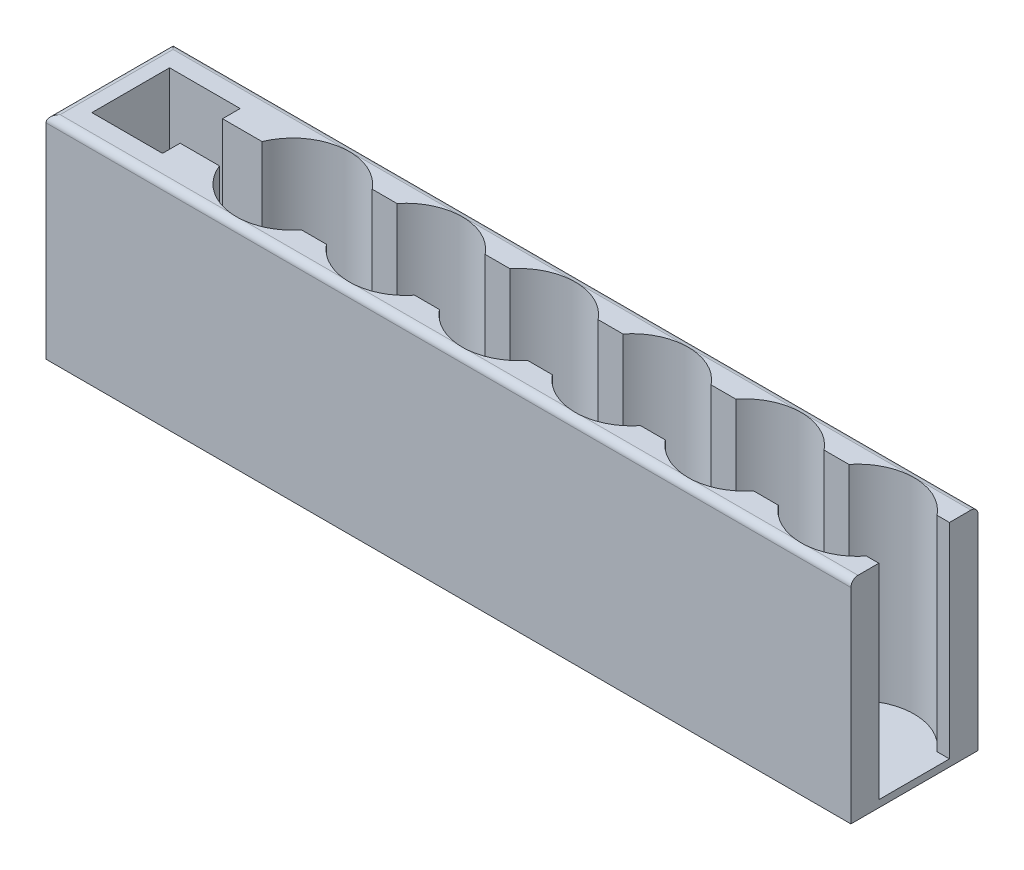
from build123d import *

# Parameters (mm, degrees)
SKETCH1_W           = 114
SKETCH1_H           = 18
BOSS_EXTRUDE1_DEPTH = 30
CUT_EXTRUDE2_DEPTH  = 29
SKETCH4_W           = 6
SKETCH4_H           = 6
CUT_EXTRUDE4_DEPTH  = 29
FILLET1_R           = 1
SKETCH5_W           = 10
SKETCH5_H           = 11
CUT_EXTRUDE6_DEPTH  = 29


with BuildPart() as part:
    # Sketch1 → Boss-Extrude1 (new body)
    with BuildSketch(Plane(origin=(0, 0, 0), x_dir=(1, 0, 0), z_dir=(0, 1, 0))):
        Rectangle(SKETCH1_W, SKETCH1_H)
    extrude(amount=BOSS_EXTRUDE1_DEPTH)

    # Sketch2 → Cut-Extrude2 (cut)
    with BuildSketch(Plane(origin=(0, 30, 0), x_dir=(1, 0, 0), z_dir=(0, 1, 0))):
        with BuildLine():
            Line((-21.244998569, 4.958042294), (-24.755000861, 4.958042294))
            ThreePointArc((-24.755000861, 4.958042294), (-39, -0.041954456), (-24.755003142, -5.041957706))
            Line((-24.755003142, -5.041957706), (-21.244997428, -5.041957706))
            ThreePointArc((-21.244997428, -5.041957706), (-15, -8.041956993), (-8.755002572, -5.041957706))
            Line((-8.755002572, -5.041957706), (-5.244997998, -5.041957706))
            ThreePointArc((-5.244997998, -5.041957706), (1, -8.041957706), (7.244997998, -5.041957706))
            Line((7.244997998, -5.041957706), (10.755002002, -5.041957706))
            ThreePointArc((10.755002002, -5.041957706), (17, -8.041957706), (23.244997998, -5.041957706))
            Line((23.244997998, -5.041957706), (26.755002002, -5.041957706))
            ThreePointArc((26.755002002, -5.041957706), (33, -8.041957706), (39.244997998, -5.041957706))
            Line((39.244997998, -5.041957706), (42.755002002, -5.041957706))
            ThreePointArc((42.755002002, -5.041957706), (49, -8.041957706), (55.244997998, -5.041957706))
            Line((55.244997998, -5.041957706), (57, -5.041957706))
            Line((57, -5.041957706), (57, 4.958042294))
            Line((57, 4.958042294), (55.244997998, 4.958042294))
            ThreePointArc((55.244997998, 4.958042294), (49, 7.958042294), (42.755002002, 4.958042294))
            Line((42.755002002, 4.958042294), (39.244997998, 4.958042294))
            ThreePointArc((39.244997998, 4.958042294), (33, 7.958042294), (26.755002002, 4.958042294))
            Line((26.755002002, 4.958042294), (23.244997998, 4.958042294))
            ThreePointArc((23.244997998, 4.958042294), (17, 7.958042294), (10.755002002, 4.958042294))
            Line((10.755002002, 4.958042294), (7.244997998, 4.958042294))
            ThreePointArc((7.244997998, 4.958042294), (1, 7.958042294), (-5.244997998, 4.958042294))
            Line((-5.244997998, 4.958042294), (-8.755001431, 4.958042294))
            ThreePointArc((-8.755001431, 4.958042294), (-15, 7.958043007), (-21.244998569, 4.958042294))
        make_face()
    extrude(amount=-CUT_EXTRUDE2_DEPTH, mode=Mode.SUBTRACT)

    # Sketch4 → Cut-Extrude4 (cut)
    with BuildSketch(Plane(origin=(0, 30, 0), x_dir=(1, 0, 0), z_dir=(0, 1, 0))):
        with Locations((-41, 0)):
            Rectangle(SKETCH4_W, SKETCH4_H)
    extrude(amount=-CUT_EXTRUDE4_DEPTH, mode=Mode.SUBTRACT)

    # Fillet1
    fillet1_edges = [part.edges().sort_by_distance(p)[0] for p in [
        (-57, 30, 0),
        (0, 30, 9),
        (0, 30, -9),
    ]]
    fillet(fillet1_edges, radius=FILLET1_R)

    # Sketch5 → Cut-Extrude6 (cut)
    with BuildSketch(Plane(origin=(0, 30, 0), x_dir=(1, 0, 0), z_dir=(0, 1, 0))):
        with Locations((-49, 0)):
            Rectangle(SKETCH5_W, SKETCH5_H)
    extrude(amount=-CUT_EXTRUDE6_DEPTH, mode=Mode.SUBTRACT)


solid = part.part
